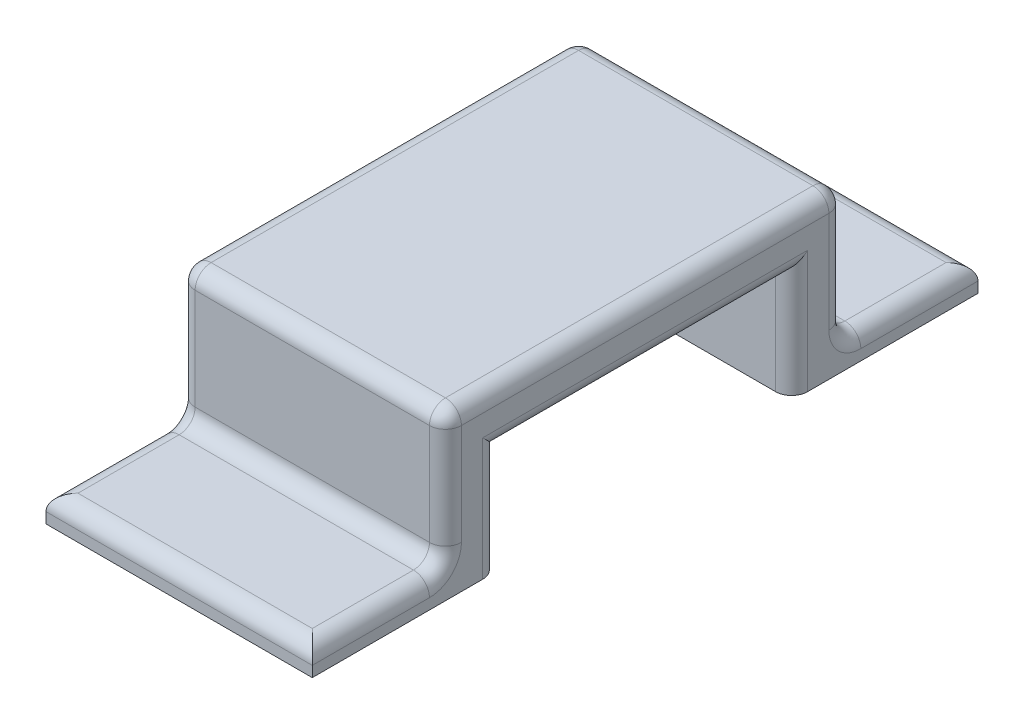
from build123d import *

# Parameters (mm, degrees)
BOSS_EXTRUDE1_DEPTH = 6.35
FILLET1_R           = 0.762


with BuildPart() as part:
    # Sketch2 → Boss-Extrude1 (new, symmetric)
    with BuildSketch(Plane(origin=(0, 0, 0), x_dir=(0, 0, -1), z_dir=(1, 0, 0))):
        Polygon((-15.875, 1.27), (-6.985, 1.27), (-6.985, 6.35), (6.985, 6.35), (6.985, 1.27), (15.875, 1.27), (15.875, 2.54), (9.525, 2.54), (9.525, 8.89), (-9.525, 8.89), (-9.525, 2.54), (-15.875, 2.54), align=None)
    extrude(amount=BOSS_EXTRUDE1_DEPTH, both=True)

    # Fillet1
    fillet1_edges = [part.edges().sort_by_distance(p)[0] for p in [
        (-6.35, 2.54, 12.7),
        (-6.35, 5.715, 9.525),
        (6.35, 3.81, 6.985),
        (-6.35, 8.89, 0),
        (-6.35, 5.715, -9.525),
        (-6.35, 2.54, -12.7),
        (-6.35, 3.81, -6.985),
        (-6.35, 6.35, 0),
        (-6.35, 3.81, 6.985),
        (6.35, 6.35, 0),
        (0, 2.54, 15.875),
        (0, 2.54, 9.525),
        (0, 8.89, 9.525),
        (6.35, 3.81, -6.985),
        (0, 8.89, -9.525),
        (0, 2.54, -9.525),
        (0, 2.54, -15.875),
        (6.35, 2.54, -12.7),
        (6.35, 5.715, -9.525),
        (6.35, 8.89, 0),
        (6.35, 5.715, 9.525),
        (6.35, 2.54, 12.7),
    ]]
    fillet(fillet1_edges, radius=FILLET1_R)


solid = part.part
